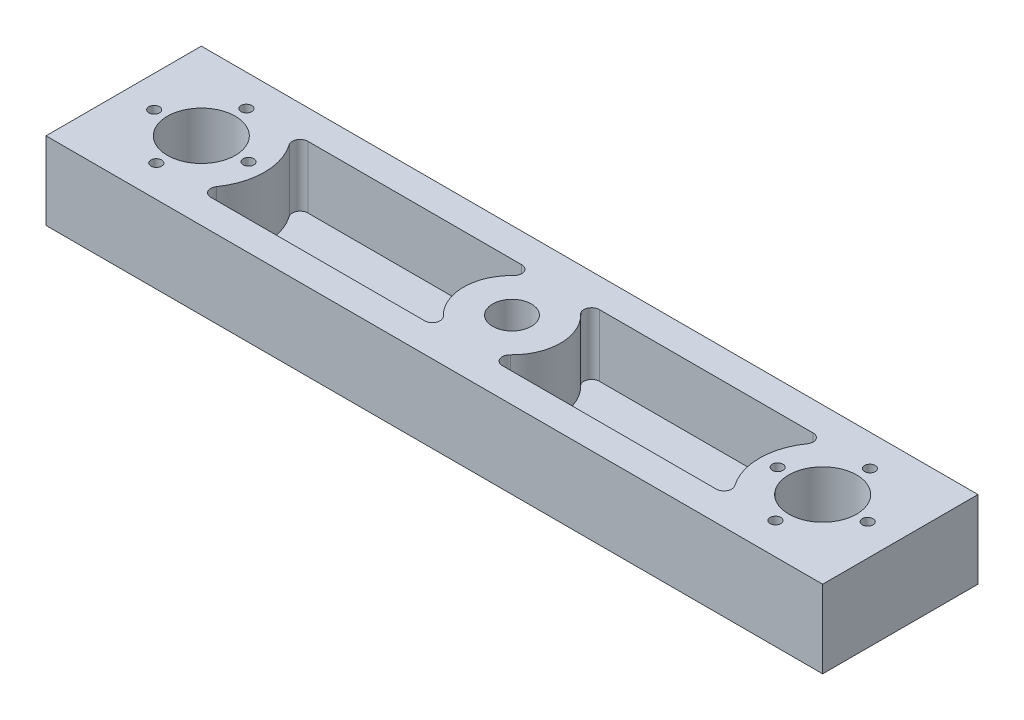
from build123d import *

# Parameters (mm, degrees)
SKETCH2_W             = 254
SKETCH2_H             = 50.8
BOSS_EXTRUDE1_DEPTH   = 25.4
SKETCH3_R             = 11.1125
SKETCH3_R_2           = 6.35
CUT_EXTRUDE1_DEPTH    = 261.272549455
F_6_32_TAPPED_HOLE1_D = 3.5052
CUT_EXTRUDE3_DEPTH    = 20.32
CIRPATTERN1_COUNT     = 4
CIRPATTERN2_COUNT     = 4


with BuildPart() as part:
    # Sketch2 → Boss-Extrude1 (new body)
    with BuildSketch(Plane(origin=(0, 0, 0), x_dir=(1, 0, 0), z_dir=(0, 1, 0))):
        with Locations((127, 25.4)):
            Rectangle(SKETCH2_W, SKETCH2_H)
    extrude(amount=BOSS_EXTRUDE1_DEPTH)

    # Sketch3 → Cut-Extrude1 (cut, through all)
    with BuildSketch(Plane(origin=(0, 25.4, 0), x_dir=(1, 0, 0), z_dir=(0, 1, 0))):
        with Locations(Location((25.4, 25.4, 0), (0, 0, 270))):
            Circle(SKETCH3_R)
        with Locations(Location((228.6, 25.4, 0), (0, 0, 270))):
            Circle(SKETCH3_R)
        with Locations(Location((127, 25.4, 0), (0, 0, 270))):
            Circle(SKETCH3_R_2)
    extrude(amount=-CUT_EXTRUDE1_DEPTH, mode=Mode.SUBTRACT)

    # #6-32 Tapped Hole1 (through all)
    with Locations(Plane(origin=(0, 25.4, 0), x_dir=(1, 0, 0), z_dir=(0, 1, 0))):
        with Locations((10.31875, 25.045657608), (243.68125, 25.045657608)):
            f_6_32_tapped_hole1 = Hole(F_6_32_TAPPED_HOLE1_D / 2)

    # Sketch6 → Cut-Extrude3 (cut)
    with BuildSketch(Plane(origin=(0, 25.4, 0), x_dir=(1, 0, 0), z_dir=(0, 1, 0))):
        with BuildLine():
            Line((44.357169653, 41.275), (114.3, 41.275))
            ThreePointArc((114.3, 41.275), (116.658330795, 39.678332318), (116.051724138, 36.895689655))
            ThreePointArc((116.051724138, 36.895689655), (111.125, 25.4), (116.051724138, 13.904310345))
            ThreePointArc((116.051724138, 13.904310345), (116.658330795, 11.121667682), (114.3, 9.525))
            Line((114.3, 9.525), (44.357169653, 9.525))
            ThreePointArc((44.357169653, 9.525), (42.102898213, 10.894589698), (42.279671609, 13.526369863))
            ThreePointArc((42.279671609, 13.526369863), (46.0375, 25.4), (42.279671609, 37.273630137))
            ThreePointArc((42.279671609, 37.273630137), (42.102898213, 39.905410302), (44.357169653, 41.275))
        make_face()
        with BuildLine():
            Line((209.642830347, 41.275), (139.7, 41.275))
            ThreePointArc((139.7, 41.275), (137.341669205, 39.678332318), (137.948275862, 36.895689655))
            ThreePointArc((137.948275862, 36.895689655), (142.875, 25.4), (137.948275862, 13.904310345))
            ThreePointArc((137.948275862, 13.904310345), (137.341669205, 11.121667682), (139.7, 9.525))
            Line((139.7, 9.525), (209.642830347, 9.525))
            ThreePointArc((209.642830347, 9.525), (211.897101787, 10.894589698), (211.720328391, 13.526369863))
            ThreePointArc((211.720328391, 13.526369863), (207.9625, 25.4), (211.720328391, 37.273630137))
            ThreePointArc((211.720328391, 37.273630137), (211.897101787, 39.905410302), (209.642830347, 41.275))
        make_face()
    extrude(amount=-CUT_EXTRUDE3_DEPTH, mode=Mode.SUBTRACT)

    # CirPattern1: #6-32 Tapped Hole1 ×4 about axis
    cirpattern1_axis = Axis((25.4, 0, -25.4), (0, 1, 0))
    for i in range(1, CIRPATTERN1_COUNT):
        add(f_6_32_tapped_hole1.rotate(cirpattern1_axis, i * 360 / CIRPATTERN1_COUNT), mode=Mode.SUBTRACT)

    # CirPattern2: #6-32 Tapped Hole1 ×4 about axis
    cirpattern2_axis = Axis((228.6, 0, -25.4), (0, 1, 0))
    for i in range(1, CIRPATTERN2_COUNT):
        add(f_6_32_tapped_hole1.rotate(cirpattern2_axis, i * 360 / CIRPATTERN2_COUNT), mode=Mode.SUBTRACT)


solid = part.part
